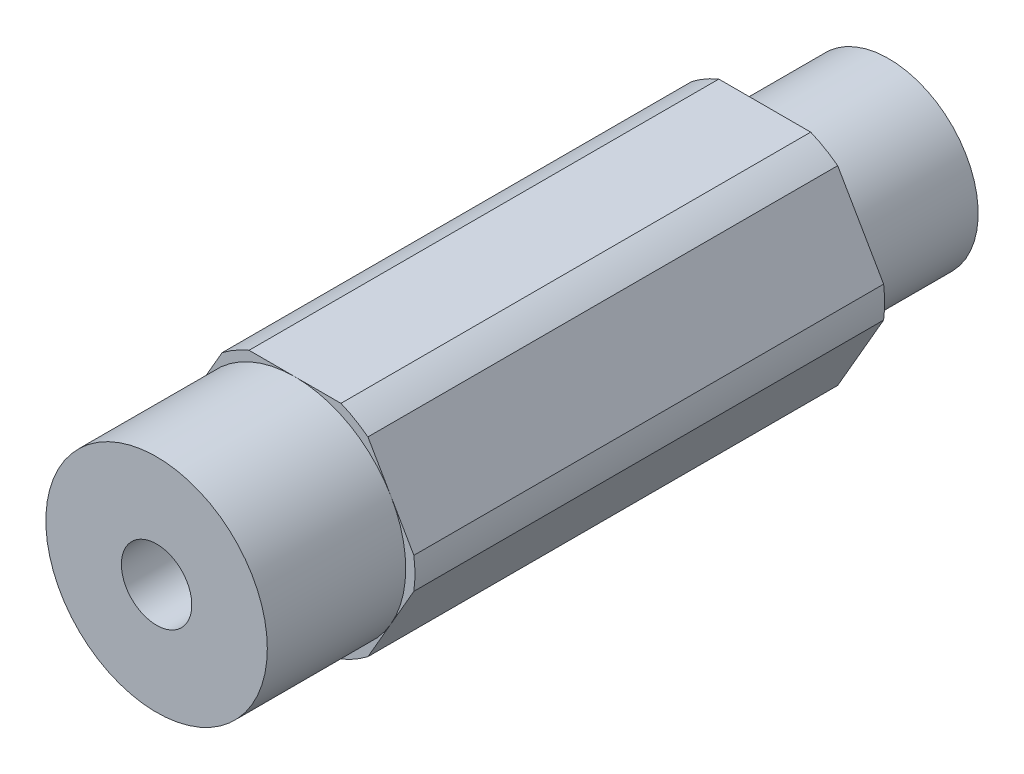
from build123d import *

# Parameters (mm, degrees)
SKETCH1_R                            = 2.0193
BOSS_EXTRUDE1_DEPTH                  = 20.9931
F_10_32_TAPPED_HOLE1_D               = 4.0386
F_10_32_TAPPED_HOLE1_DEPTH           = 11.938
F_10_32_TAPPED_HOLE1_TIP             = 1.213317848
F_10_32_TAPPED_HOLE1_ON_FACE_2_D     = 4.0386
F_10_32_TAPPED_HOLE1_ON_FACE_2_DEPTH = 11.938
F_10_32_TAPPED_HOLE1_ON_FACE_2_TIP   = 1.213317848
SKETCH4_R                            = 8.89
SKETCH4_R_2                          = 6.35
CUT_EXTRUDE_THIN1_DEPTH              = 7.9375
SKETCH5_R                            = 7.665000037
SKETCH5_R_2                          = 5.125000037
CUT_EXTRUDE_THIN2_DEPTH              = 7.112


with BuildPart() as part:
    # Sketch1 → Boss-Extrude1 (new, symmetric)
    with BuildSketch(Plane.XY):
        with BuildLine():
            ThreePointArc((6.874999966, 0), (6.860422465, 0.447468582), (6.816751782, 0.893039571))
            Line((6.816751782, 0.893039571), (4.181770846, 5.456960429))
            ThreePointArc((4.181770846, 5.456960429), (3.437499983, 5.953924622), (2.634980936, 6.35))
            Line((2.634980936, 6.35), (-2.634980936, 6.35))
            ThreePointArc((-2.634980936, 6.35), (-3.437499983, 5.953924622), (-4.181770846, 5.456960429))
            Line((-4.181770846, 5.456960429), (-6.816751782, 0.893039571))
            ThreePointArc((-6.816751782, 0.893039571), (-6.874999966, 0), (-6.816751782, -0.893039571))
            Line((-6.816751782, -0.893039571), (-4.181770846, -5.456960429))
            ThreePointArc((-4.181770846, -5.456960429), (-3.437499983, -5.953924622), (-2.634980936, -6.35))
            Line((-2.634980936, -6.35), (2.634980936, -6.35))
            ThreePointArc((2.634980936, -6.35), (3.437499983, -5.953924622), (4.181770846, -5.456960429))
            Line((4.181770846, -5.456960429), (6.816751782, -0.893039571))
            ThreePointArc((6.816751782, -0.893039571), (6.860422465, -0.447468582), (6.874999966, 0))
        make_face()
        with Locations(Location((0, 0, 0), (0, 0, 180))):
            Circle(SKETCH1_R, mode=Mode.SUBTRACT)
    extrude(amount=BOSS_EXTRUDE1_DEPTH, both=True)

    # #10-32 Tapped Hole1
    with Locations(Plane.XY.offset(20.9931)):
        with Locations((0, 0)):
            Hole(F_10_32_TAPPED_HOLE1_D / 2, depth=F_10_32_TAPPED_HOLE1_DEPTH)
            with Locations((0, 0, -(F_10_32_TAPPED_HOLE1_DEPTH + F_10_32_TAPPED_HOLE1_TIP / 2))):  # 118° drill point
                Cone(0, F_10_32_TAPPED_HOLE1_D / 2, F_10_32_TAPPED_HOLE1_TIP, mode=Mode.SUBTRACT)

    # #10-32 Tapped Hole1 on face 2
    with Locations(Plane.XY.offset(-20.9931)):
        with Locations((0, 0)):
            Hole(F_10_32_TAPPED_HOLE1_ON_FACE_2_D / 2, depth=F_10_32_TAPPED_HOLE1_ON_FACE_2_DEPTH)
            with Locations((0, 0, -(F_10_32_TAPPED_HOLE1_ON_FACE_2_DEPTH + F_10_32_TAPPED_HOLE1_ON_FACE_2_TIP / 2))):  # 118° drill point
                Cone(0, F_10_32_TAPPED_HOLE1_ON_FACE_2_D / 2, F_10_32_TAPPED_HOLE1_ON_FACE_2_TIP, mode=Mode.SUBTRACT)

    # Sketch4 → Cut-Extrude-Thin1 (cut)
    with BuildSketch(Plane.XY.offset(20.9931)):
        Circle(SKETCH4_R)
        Circle(SKETCH4_R_2, mode=Mode.SUBTRACT)
    extrude(amount=-CUT_EXTRUDE_THIN1_DEPTH, mode=Mode.SUBTRACT)

    # Sketch5 → Cut-Extrude-Thin2 (cut)
    with BuildSketch(Plane(origin=(0, 0, -20.9931), x_dir=(-1, 0, 0), z_dir=(0, 0, -1))):
        Circle(SKETCH5_R)
        Circle(SKETCH5_R_2, mode=Mode.SUBTRACT)
    extrude(amount=-CUT_EXTRUDE_THIN2_DEPTH, mode=Mode.SUBTRACT)


solid = part.part
